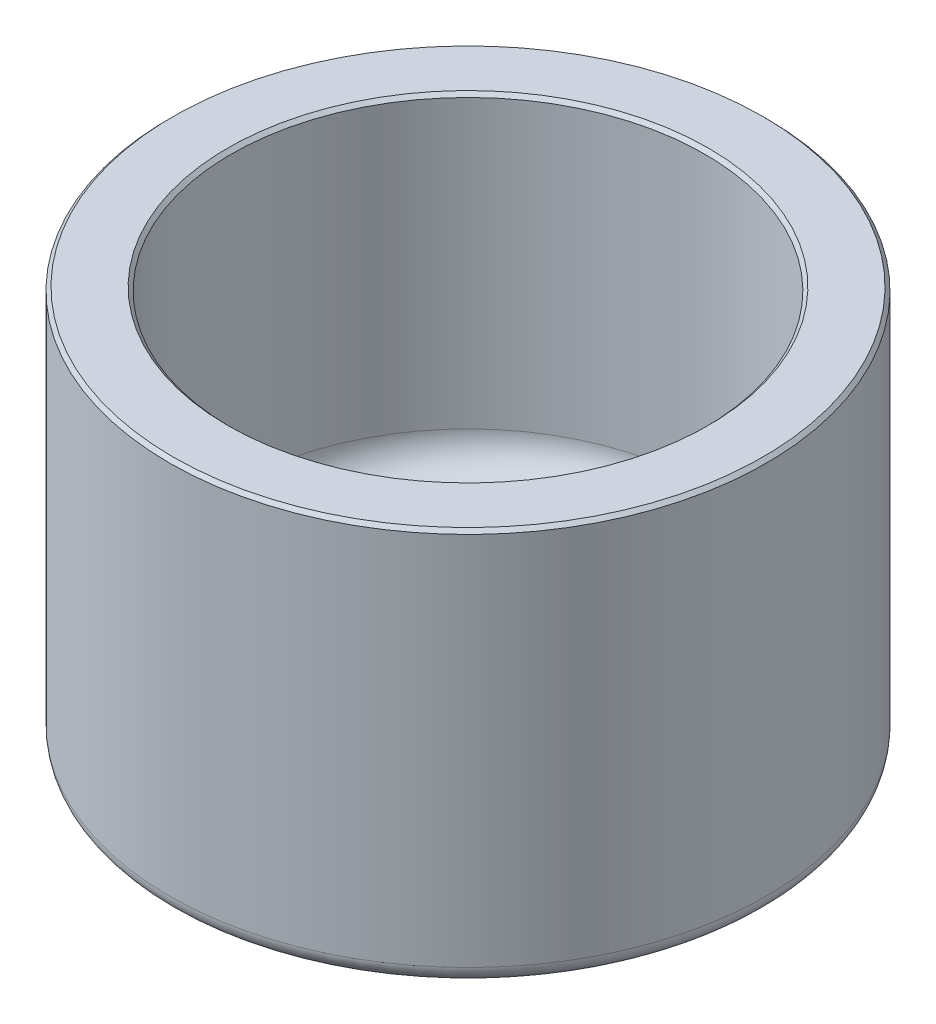
from build123d import *

# Parameters (mm, degrees)
FILLET1_R     = 1
FILLET2_R     = 2
CHAMFER1_SIZE = 0.2


with BuildPart() as part:
    # Sketch1 → Revolve1 (revolve)
    with BuildSketch(Plane.XY, mode=Mode.PRIVATE) as revolve1_sk:
        Polygon((0, 0), (-16.95, 0), (-16.95, 22.5), (-13.45, 22.5), (-13.45, 4), (0, 4), align=None)
    revolve(revolve1_sk.sketch.rotate(Axis((0, 4, 0), (0, -1, 0)), 270), axis=Axis((0, 4, 0), (0, -1, 0)))

    # Fillet1
    fillet1_edges = [part.edges().sort_by_distance(p)[0] for p in [
        (0, 0, -16.95),
    ]]
    fillet(fillet1_edges, radius=FILLET1_R)

    # Fillet2
    fillet2_edges = [part.edges().sort_by_distance(p)[0] for p in [
        (0, 4, -13.45),
    ]]
    fillet(fillet2_edges, radius=FILLET2_R)

    # Chamfer1
    chamfer1_edges = [part.edges().sort_by_distance(p)[0] for p in [
        (0, 22.5, -13.45),
        (0, 22.5, -16.95),
    ]]
    chamfer(chamfer1_edges, length=CHAMFER1_SIZE)


solid = part.part
